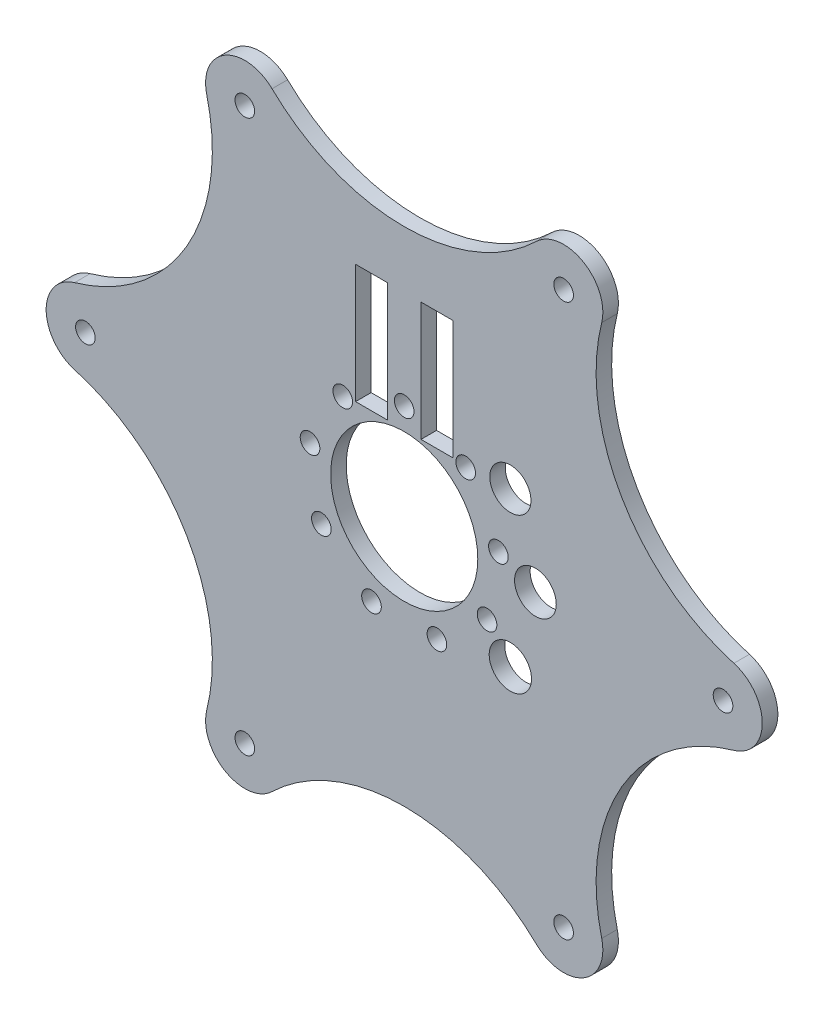
from build123d import *

# Parameters (mm, degrees)
SKETCH2_R           = 4
SKETCH2_R_2         = 30
SKETCH2_R_3         = 8.623329564
SKETCH2_R_4         = 8.505813098
SKETCH2_R_5         = 8.401963559
SKETCH2_W           = 13
SKETCH2_H           = 48.5
BOSS_EXTRUDE1_DEPTH = 6.35


with BuildPart() as part:
    # Sketch2 → Boss-Extrude1 (new body)
    with BuildSketch(Plane.XY):
        with BuildLine():
            ThreePointArc((80.527805435, 108.72490148), (73, 126.439708953), (53.894623988, 124.101575958))
            ThreePointArc((53.894623988, 124.101575958), (29.058945383, 107.994153026), (0, 102.351662573))
            ThreePointArc((0, 102.351662573), (-29.058945383, 107.994153026), (-53.894623988, 124.101575958))
            ThreePointArc((-53.894623988, 124.101575958), (-73, 126.439708953), (-80.527805435, 108.72490148))
            ThreePointArc((-80.527805435, 108.72490148), (-78.996207289, 79.162861422), (-88.639139908, 51.175831286))
            ThreePointArc((-88.639139908, 51.175831286), (-108.055152672, 28.831291604), (-134.422429423, 15.376674478))
            ThreePointArc((-134.422429423, 15.376674478), (-146, 0), (-134.422429423, -15.376674478))
            ThreePointArc((-134.422429423, -15.376674478), (-108.055152672, -28.831291604), (-88.639139908, -51.175831286))
            ThreePointArc((-88.639139908, -51.175831286), (-78.996207289, -79.162861422), (-80.527805435, -108.72490148))
            ThreePointArc((-80.527805435, -108.72490148), (-73, -126.439708953), (-53.894623988, -124.101575958))
            ThreePointArc((-53.894623988, -124.101575958), (-29.058945383, -107.994153026), (0, -102.351662573))
            ThreePointArc((0, -102.351662573), (29.058945383, -107.994153026), (53.894623988, -124.101575958))
            ThreePointArc((53.894623988, -124.101575958), (73, -126.439708953), (80.527805435, -108.72490148))
            ThreePointArc((80.527805435, -108.72490148), (78.996207289, -79.162861422), (88.639139908, -51.175831286))
            ThreePointArc((88.639139908, -51.175831286), (108.055152672, -28.831291604), (134.422429423, -15.376674478))
            ThreePointArc((134.422429423, -15.376674478), (146, 0), (134.422429423, 15.376674478))
            ThreePointArc((134.422429423, 15.376674478), (108.055152672, 28.831291604), (88.639139908, 51.175831286))
            ThreePointArc((88.639139908, 51.175831286), (78.996207289, 79.162861422), (80.527805435, 108.72490148))
        make_face()
        with Locations((65, 112.583302492)):
            Circle(SKETCH2_R, mode=Mode.SUBTRACT)
        with Locations((130, 0)):
            Circle(SKETCH2_R, mode=Mode.SUBTRACT)
        with Locations((65, -112.583302492)):
            Circle(SKETCH2_R, mode=Mode.SUBTRACT)
        with Locations((-65, -112.583302492)):
            Circle(SKETCH2_R, mode=Mode.SUBTRACT)
        with Locations((-130, 0)):
            Circle(SKETCH2_R, mode=Mode.SUBTRACT)
        with Locations((-65, 112.583302492)):
            Circle(SKETCH2_R, mode=Mode.SUBTRACT)
        with Locations((25.068716778, 29.875733282)):
            Circle(SKETCH2_R, mode=Mode.SUBTRACT)
        with Locations((38.407502367, 6.772278929)):
            Circle(SKETCH2_R, mode=Mode.SUBTRACT)
        with Locations((33.774990748, -19.5)):
            Circle(SKETCH2_R, mode=Mode.SUBTRACT)
        with Locations((13.33878559, -36.648012211)):
            Circle(SKETCH2_R, mode=Mode.SUBTRACT)
        with Locations((-13.33878559, -36.648012211)):
            Circle(SKETCH2_R, mode=Mode.SUBTRACT)
        with Locations((-33.774990748, -19.5)):
            Circle(SKETCH2_R, mode=Mode.SUBTRACT)
        with Locations((-38.407502367, 6.772278929)):
            Circle(SKETCH2_R, mode=Mode.SUBTRACT)
        with Locations((-25.068716778, 29.875733282)):
            Circle(SKETCH2_R, mode=Mode.SUBTRACT)
        Circle(SKETCH2_R_2, mode=Mode.SUBTRACT)
        with Locations((43.278364114, -31.443572071)):
            Circle(SKETCH2_R_3, mode=Mode.SUBTRACT)
        with Locations((53.495, 0)):
            Circle(SKETCH2_R_4, mode=Mode.SUBTRACT)
        with Locations((43.278364114, 31.443572071)):
            Circle(SKETCH2_R_5, mode=Mode.SUBTRACT)
        with Locations((0, 39)):
            Circle(SKETCH2_R, mode=Mode.SUBTRACT)
        with Locations((-13.33878559, 54.898012211)):
            Rectangle(SKETCH2_W, SKETCH2_H, mode=Mode.SUBTRACT)
        with Locations((13.33878559, 54.898012211)):
            Rectangle(SKETCH2_W, SKETCH2_H, mode=Mode.SUBTRACT)
    extrude(amount=BOSS_EXTRUDE1_DEPTH)


solid = part.part
